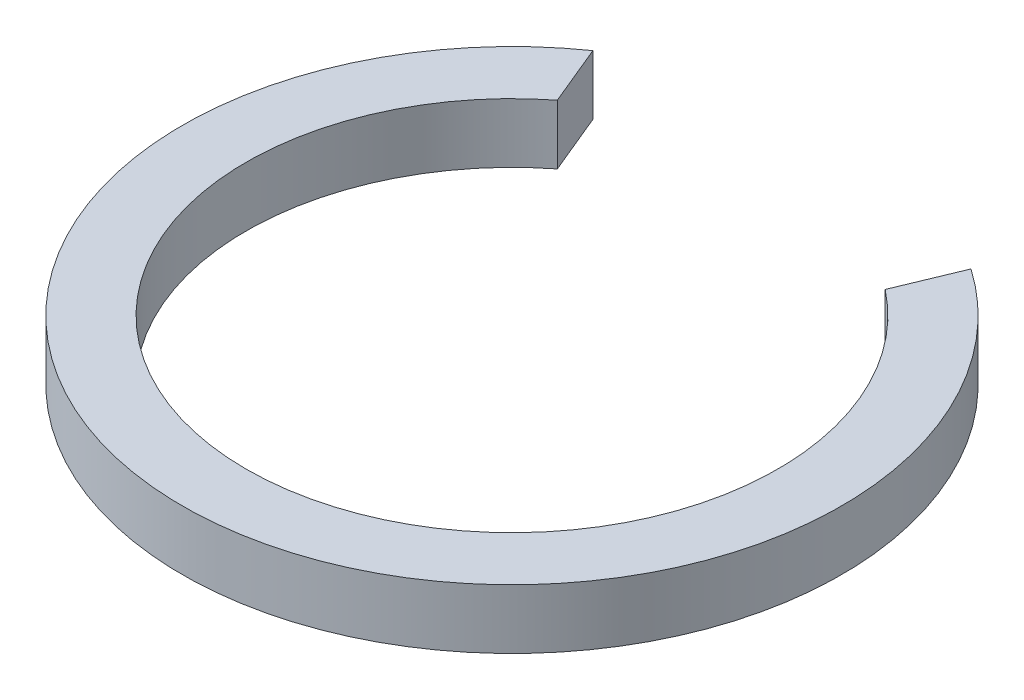
from build123d import *

# Parameters (mm, degrees)
BOSS_EXTRUDE1_DEPTH = 1.4


with BuildPart() as part:
    # Sketch1 → Boss-Extrude1 (new body)
    with BuildSketch(Plane(origin=(0, 0, 0), x_dir=(1, 0, 0), z_dir=(0, 1, 0))):
        with BuildLine():
            Line((3.85374342, 4.920483884), (4.445217382, 6.348428343))
            ThreePointArc((4.445217382, 6.348428343), (0, -7.75), (-4.445217382, 6.348428343))
            Line((-4.445217382, 6.348428343), (-3.85374342, 4.920483884))
            ThreePointArc((-3.85374342, 4.920483884), (0, -6.25), (3.85374342, 4.920483884))
        make_face()
    extrude(amount=BOSS_EXTRUDE1_DEPTH)


solid = part.part
